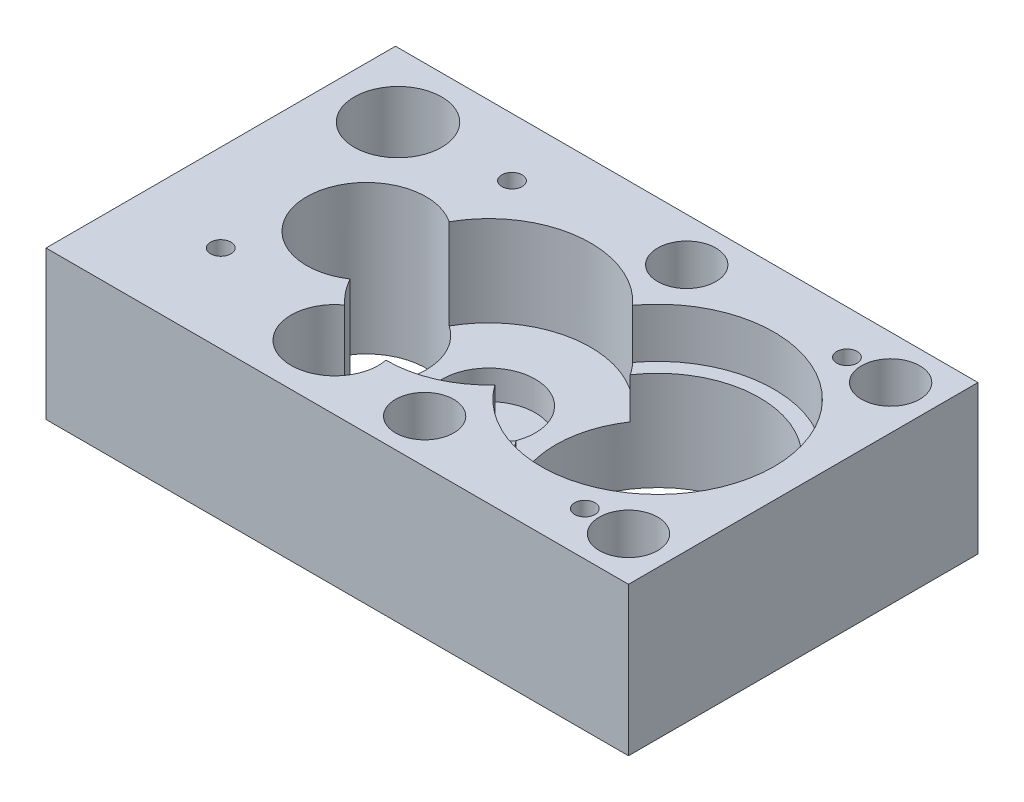
from build123d import *
from build123d.topology import SkipClean

# Parameters (mm, degrees)
SKETCH_1_W          = 20
SKETCH_1_H          = 12
SKETCH_1_R          = 2.05
SKETCH_1_R_2        = 3.5
EXTRUDE_1_DEPTH     = 2
CUT_EXTRUDE_START   = 2
SKETCH_1_3_R        = 1.6
CUT_EXTRUDE_6_DEPTH = 1
SKETCH_3_W          = 20
SKETCH_3_H          = 12
EXTRUDE_3_DEPTH     = 1.4
EXTRUDE_START       = 1.4
SKETCH_3_17_W       = 20
SKETCH_3_17_H       = 12
EXTRUDE_4_DEPTH     = 1.7
CUT_EXTRUDE_START_2 = 5.1
SKETCH_5_R          = 0.9
CUT_EXTRUDE_1_DEPTH = 29.974882199
SKETCH_5_10_R       = 1.5
CUT_EXTRUDE_3_DEPTH = 4.6
SKETCH_7_R          = 0.35
SKETCH_7_R_2        = 0.7
CUT_EXTRUDE_4_DEPTH = 24.874882199
SKETCH_7_3_R        = 1
CUT_EXTRUDE_7_DEPTH = 3.1


with BuildPart() as part:
    # 草图1 → 凸台-拉伸1 (new body)
    with BuildSketch(Plane(origin=(0, 0, 0), x_dir=(1, 0, 0), z_dir=(0, 1, 0))):
        with Locations((10, -6)):
            Rectangle(SKETCH_1_W, SKETCH_1_H)
        with Locations(Location((5, -6, 0), (0, 0, 270))):
            Circle(SKETCH_1_R, mode=Mode.SUBTRACT)
        with Locations(Location((15, -6, 0), (0, 0, 270))):
            Circle(SKETCH_1_R_2, mode=Mode.SUBTRACT)
    extrude(amount=EXTRUDE_1_DEPTH)

    # 草图1<3> → 切除-拉伸6 (cut)
    with BuildSketch(Plane(origin=(0, 0, 0), x_dir=(1, 0, 0), z_dir=(0, 1, 0)).offset(CUT_EXTRUDE_START)):
        with Locations(Location((9.2, -6, 0), (0, 0, 270))):
            Circle(SKETCH_1_3_R)
    extrude(amount=-CUT_EXTRUDE_6_DEPTH, mode=Mode.SUBTRACT)

    # 草图3 → 凸台-拉伸3 (add)
    with SkipClean():  # the faces are left unmerged after this step: merging them gives an invalid solid
        with BuildSketch(Plane(origin=(0, 2, 0), x_dir=(1, 0, 0), z_dir=(0, 1, 0))):
            with Locations((10, -6)):
                Rectangle(SKETCH_3_W, SKETCH_3_H)
            with BuildLine():
                ThreePointArc((6.141964286, -7.702473956), (2.95, -6), (6.141964286, -4.297526044))
                ThreePointArc((6.141964286, -4.297526044), (9.04909865, -2.503254544), (12.1, -4.040408206))
                ThreePointArc((12.1, -4.040408206), (18.5, -6), (12.1, -7.959591794))
                ThreePointArc((12.1, -7.959591794), (9.04909865, -9.496745456), (6.141964286, -7.702473956))
            make_face(mode=Mode.SUBTRACT)
        extrude(amount=EXTRUDE_3_DEPTH)

    # 草图3<17> → 凸台-拉伸4 (add)
    with SkipClean():  # the faces are left unmerged after this step: merging them gives an invalid solid
        with BuildSketch(Plane(origin=(0, 2, 0), x_dir=(1, 0, 0), z_dir=(0, 1, 0)).offset(EXTRUDE_START)):
            with Locations((10, -6)):
                Rectangle(SKETCH_3_17_W, SKETCH_3_17_H)
            with BuildLine():
                ThreePointArc((6.141964286, -7.702473956), (2.95, -6), (6.141964286, -4.297526044))
                ThreePointArc((6.141964286, -4.297526044), (8.789071626, -2.524206872), (11.776724138, -3.631352133))
                ThreePointArc((11.776724138, -3.631352133), (16.246374051, -2.199138029), (19, -6))
                ThreePointArc((19, -6), (16.246374051, -9.800861971), (11.776724138, -8.368647867))
                ThreePointArc((11.776724138, -8.368647867), (8.789071626, -9.475793128), (6.141964286, -7.702473956))
            make_face(mode=Mode.SUBTRACT)
        extrude(amount=EXTRUDE_4_DEPTH)

    # 草图5 → 切除-拉伸1 (cut, through all)
    with SkipClean():  # the faces are left unmerged after this step: merging them gives an invalid solid
        with BuildSketch(Plane(origin=(0, 0, 0), x_dir=(1, 0, 0), z_dir=(0, 1, 0)).offset(CUT_EXTRUDE_START_2)):
            with Locations(Location((2.3, -2.214171161, 0), (0, 0, 270))):
                Circle(SKETCH_5_R)
            with Locations(Location((7.7, -9.785828839, 0), (0, 0, 270))):
                Circle(SKETCH_5_R)
        extrude(amount=-CUT_EXTRUDE_1_DEPTH, mode=Mode.SUBTRACT)

    # 草图5<10> → 切除-拉伸3 (cut)
    with SkipClean():  # the faces are left unmerged after this step: merging them gives an invalid solid
        with BuildSketch(Plane(origin=(0, 0, 0), x_dir=(1, 0, 0), z_dir=(0, 1, 0)).offset(CUT_EXTRUDE_START_2)):
            with Locations(Location((2.3, -2.214171161, 0), (0, 0, 270))):
                Circle(SKETCH_5_10_R)
            with Locations(Location((7.7, -9.785828839, 0), (0, 0, 270))):
                Circle(SKETCH_5_10_R)
        extrude(amount=-CUT_EXTRUDE_3_DEPTH, mode=Mode.SUBTRACT)

    # 草图7 → 切除-拉伸4 (cut, through all)
    with SkipClean():  # the faces are left unmerged after this step: merging them gives an invalid solid
        with BuildSketch(Plane(origin=(0, 5.1, 0), x_dir=(1, 0, 0), z_dir=(0, 1, 0))):
            with Locations(Location((6, -2, 0), (0, 0, 270))):
                Circle(SKETCH_7_R)
            with Locations(Location((3, -9, 0), (0, 0, 270))):
                Circle(SKETCH_7_R)
            with Locations(Location((17, -1.5, 0), (0, 0, 270))):
                Circle(SKETCH_7_R)
            with Locations(Location((17, -10.5, 0), (0, 0, 270))):
                Circle(SKETCH_7_R)
            with Locations(Location((11.5, -1.5, 0), (0, 0, 270))):
                Circle(SKETCH_7_R_2)
            with Locations(Location((18.5, -10.5, 0), (0, 0, 270))):
                Circle(SKETCH_7_R_2)
            with Locations(Location((11.5, -10.5, 0), (0, 0, 270))):
                Circle(SKETCH_7_R_2)
            with Locations(Location((18.5, -1.5, 0), (0, 0, 270))):
                Circle(SKETCH_7_R_2)
        extrude(amount=-CUT_EXTRUDE_4_DEPTH, mode=Mode.SUBTRACT)

    # 草图7<3> → 切除-拉伸7 (cut)
    with SkipClean():  # the faces are left unmerged after this step: merging them gives an invalid solid
        with BuildSketch(Plane(origin=(0, 5.1, 0), x_dir=(1, 0, 0), z_dir=(0, 1, 0))):
            with Locations(Location((11.5, -1.5, 0), (0, 0, 270))):
                Circle(SKETCH_7_3_R)
            with Locations(Location((18.5, -10.5, 0), (0, 0, 270))):
                Circle(SKETCH_7_3_R)
            with Locations(Location((11.5, -10.5, 0), (0, 0, 270))):
                Circle(SKETCH_7_3_R)
            with Locations(Location((18.5, -1.5, 0), (0, 0, 270))):
                Circle(SKETCH_7_3_R)
        extrude(amount=-CUT_EXTRUDE_7_DEPTH, mode=Mode.SUBTRACT)


solid = part.part
